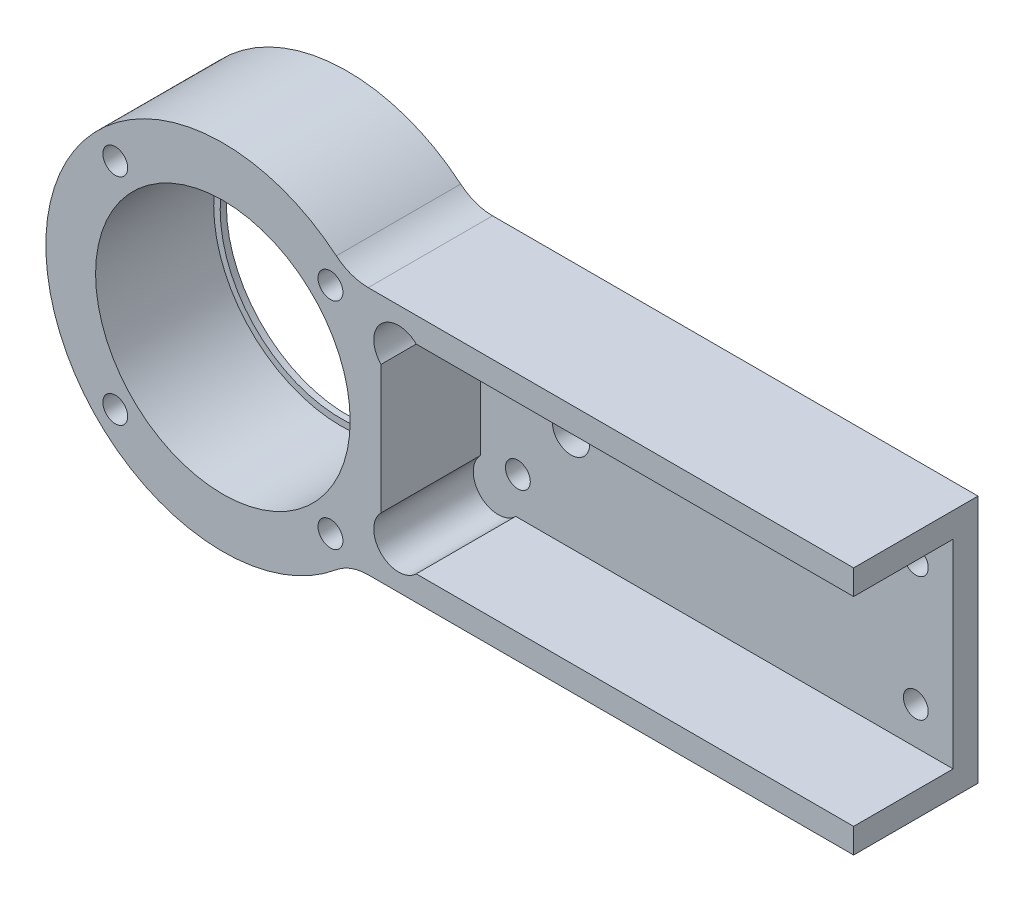
from build123d import *

# Parameters (mm, degrees)
SKETCH1_R               = 32.5
SKETCH1_W               = 120.65
SKETCH1_H               = 50.8
BOSS_EXTRUDE2_DEPTH     = 6.35
BOSS_EXTRUDE3_START     = 6.35
SKETCH1_3_R             = 32.5
BOSS_EXTRUDE3_DEPTH     = 25.4
CUT_EXTRUDE1_DEPTH      = 170.176810751
CUT_EXTRUDE1_DEPTH_BACK = 170.176810751
SKETCH2_R               = 3.175
SKETCH3_R               = 6.35
CUT_EXTRUDE2_DEPTH      = 25.4
SKETCH4_3_R             = 4.7625
CUT_EXTRUDE3_DEPTH      = 6.35
FILLET1_R               = 12.7
SKETCH5_R               = 32.5
SKETCH5_R_2             = 30.849
BOSS_EXTRUDE6_DEPTH     = 1.5875


with BuildPart() as part:
    # Sketch1 → Boss-Extrude2 (new body)
    # profile 1 of 2: a face of its own
    with BuildSketch(Plane.XY):
        with BuildLine():
            Line((32.171066193, 31.75), (161.036, 31.75))
            Line((161.036, 31.75), (161.036, 25.4))
            Line((161.036, 25.4), (40.386, 25.4))
            Line((40.386, 25.4), (40.386, -25.4))
            Line((40.386, -25.4), (161.036, -25.4))
            Line((161.036, -25.4), (161.036, -31.75))
            Line((161.036, -31.75), (32.171066193, -31.75))
            ThreePointArc((32.171066193, -31.75), (-45.2, 0), (32.171066193, 31.75))
        make_face()
        Circle(SKETCH1_R, mode=Mode.SUBTRACT)
    # profile 2 of 2: a face of its own
    with BuildSketch(Plane.XY):
        with Locations((100.711, 0)):
            Rectangle(SKETCH1_W, SKETCH1_H)
    extrude(amount=BOSS_EXTRUDE2_DEPTH)

    # Sketch1<3> → Boss-Extrude3 (add)
    with BuildSketch(Plane.XY.offset(BOSS_EXTRUDE3_START)):
        with BuildLine():
            Line((32.171066193, 31.75), (161.036, 31.75))
            Line((161.036, 31.75), (161.036, 25.4))
            Line((161.036, 25.4), (40.386, 25.4))
            Line((40.386, 25.4), (40.386, -25.4))
            Line((40.386, -25.4), (161.036, -25.4))
            Line((161.036, -25.4), (161.036, -31.75))
            Line((161.036, -31.75), (32.171066193, -31.75))
            ThreePointArc((32.171066193, -31.75), (-45.2, 0), (32.171066193, 31.75))
        make_face()
        Circle(SKETCH1_3_R, mode=Mode.SUBTRACT)
    extrude(amount=BOSS_EXTRUDE3_DEPTH)

    # Sketch2 → Cut-Extrude1 (cut, two sides: drawn at the far end of the back side and taken through both)
    with BuildSketch(Plane.XY.offset(6.35).offset(-CUT_EXTRUDE1_DEPTH_BACK)):
        with Locations((49.911, 15.875)):
            Circle(SKETCH2_R)
        with Locations((151.511, 15.875)):
            Circle(SKETCH2_R)
        with Locations((151.511, -15.875)):
            Circle(SKETCH2_R)
        with Locations((49.911, -15.875)):
            Circle(SKETCH2_R)
        with Locations((27.471098449, 27.471098449)):
            Circle(SKETCH2_R)
        with Locations((27.471098449, -27.471098449)):
            Circle(SKETCH2_R)
        with Locations((-27.471098449, -27.471098449)):
            Circle(SKETCH2_R)
        with Locations((-27.471098449, 27.471098449)):
            Circle(SKETCH2_R)
    extrude(amount=CUT_EXTRUDE1_DEPTH + CUT_EXTRUDE1_DEPTH_BACK, mode=Mode.SUBTRACT)

    # Sketch3 → Cut-Extrude2 (cut)
    with BuildSketch(Plane.XY.offset(31.75)):
        with Locations((44.876128061, 20.909871939)):
            Circle(SKETCH3_R)
        with Locations((44.876128061, -20.909871939)):
            Circle(SKETCH3_R)
    extrude(amount=-CUT_EXTRUDE2_DEPTH, mode=Mode.SUBTRACT)

    # Sketch4<3> → Cut-Extrude3 (cut)
    with BuildSketch(Plane(origin=(0, 0, 0), x_dir=(-1, 0, 0), z_dir=(0, 0, -1))):
        with Locations((-63.5, 0)):
            Circle(SKETCH4_3_R)
    extrude(amount=-CUT_EXTRUDE3_DEPTH, mode=Mode.SUBTRACT)

    # Fillet1
    fillet1_edges = [part.edges().sort_by_distance(p)[0] for p in [
        (32.171066193, -31.75, 15.875),
        (32.171066193, 31.75, 15.875),
    ]]
    fillet(fillet1_edges, radius=FILLET1_R)

    # Sketch5 → Boss-Extrude6 (add)
    with BuildSketch(Plane(origin=(0, 0, 0), x_dir=(-1, 0, 0), z_dir=(0, 0, -1))):
        Circle(SKETCH5_R)
        Circle(SKETCH5_R_2, mode=Mode.SUBTRACT)
    extrude(amount=-BOSS_EXTRUDE6_DEPTH)


solid = part.part
